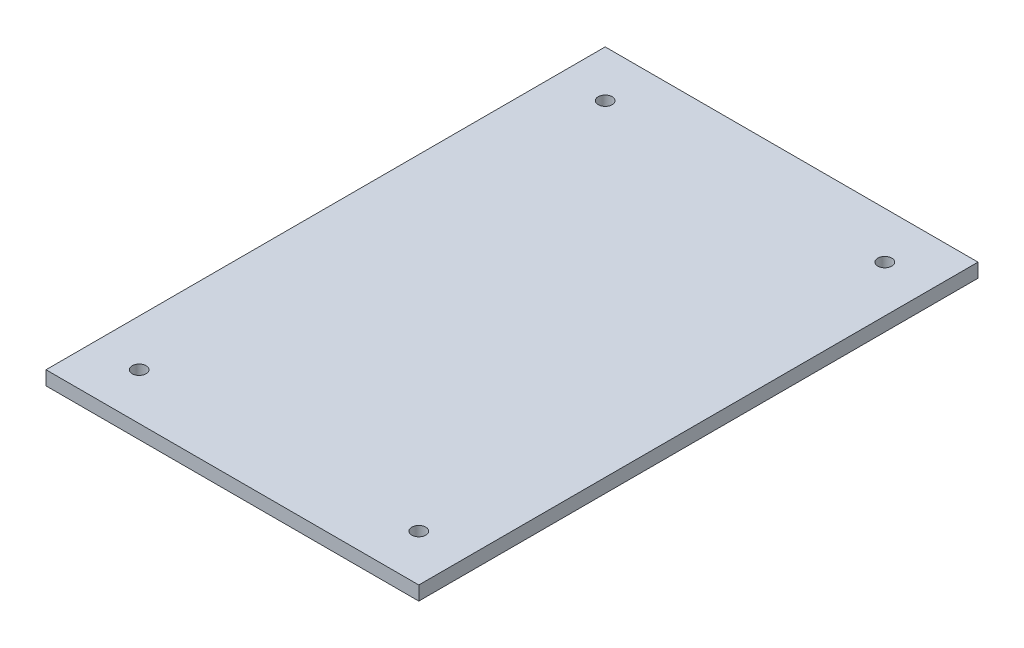
from build123d import *

# Parameters (mm, degrees)
SKETCH1_W           = 80
SKETCH1_H           = 120
BOSS_EXTRUDE1_DEPTH = 3
SKETCH3_R           = 1.5
CUT_EXTRUDE2_DEPTH  = 3


with BuildPart() as part:
    # Sketch1 → Boss-Extrude1 (new body)
    with BuildSketch(Plane(origin=(0, 0, 0), x_dir=(1, 0, 0), z_dir=(0, 1, 0))):
        Rectangle(SKETCH1_W, SKETCH1_H)
    extrude(amount=BOSS_EXTRUDE1_DEPTH)

    # Sketch3 → Cut-Extrude2 (cut)
    with BuildSketch(Plane(origin=(0, 3, 0), x_dir=(1, 0, 0), z_dir=(0, 1, 0))):
        with Locations(Location((-30, -50, 0), (0, 0, 270))):
            Circle(SKETCH3_R)
        with Locations(Location((30, -50, 0), (0, 0, 90))):
            Circle(SKETCH3_R)
        with Locations(Location((30, 50, 0), (0, 0, 270))):
            Circle(SKETCH3_R)
        with Locations(Location((-30, 50, 0), (0, 0, 90))):
            Circle(SKETCH3_R)
    extrude(amount=-CUT_EXTRUDE2_DEPTH, mode=Mode.SUBTRACT)


solid = part.part
